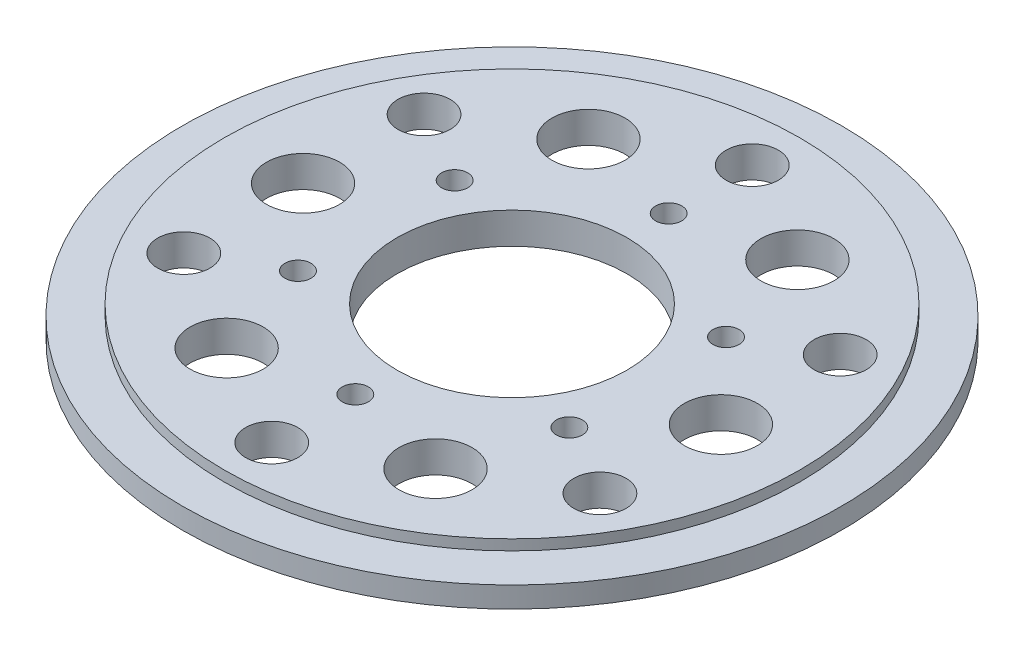
from build123d import *

# Parameters (mm, degrees)
SKETCH1_R             = 27.55
SKETCH1_R_2           = 11
BOSS_EXTRUDE1_DEPTH   = 3
SKETCH1_3_R           = 31.55
SKETCH1_3_R_2         = 27.55
BOSS_EXTRUDE2_DEPTH   = 2
M3X0_5_TAPPED_HOLE1_D = 2.5
SKETCH6_R             = 3.5
SKETCH6_R_2           = 2.5
CUT_EXTRUDE1_DEPTH    = 45.719179331
CIRPATTERN1_COUNT     = 6


with BuildPart() as part:
    # Sketch1 → Boss-Extrude1 (new body)
    with BuildSketch(Plane(origin=(0, 0, 0), x_dir=(1, 0, 0), z_dir=(0, 1, 0))):
        Circle(SKETCH1_R)
        Circle(SKETCH1_R_2, mode=Mode.SUBTRACT)
    extrude(amount=BOSS_EXTRUDE1_DEPTH)

    # Sketch1<3> → Boss-Extrude2 (add)
    with BuildSketch(Plane(origin=(0, 0, 0), x_dir=(1, 0, 0), z_dir=(0, 1, 0))):
        Circle(SKETCH1_3_R)
        Circle(SKETCH1_3_R_2, mode=Mode.SUBTRACT)
    extrude(amount=BOSS_EXTRUDE2_DEPTH)

    # M3x0.5 Tapped Hole1 (through all)
    with Locations(Plane(origin=(0, 3, 0), x_dir=(1, 0, 0), z_dir=(0, 1, 0))):
        with Locations((0, 15)):
            m3x0_5_tapped_hole1 = Hole(M3X0_5_TAPPED_HOLE1_D / 2)

    # Sketch6 → Cut-Extrude1 (cut, through all)
    with BuildSketch(Plane(origin=(0, 3, 0), x_dir=(1, 0, 0), z_dir=(0, 1, 0))):
        with Locations((20, 0)):
            Circle(SKETCH6_R)
        with Locations((0, 23)):
            Circle(SKETCH6_R_2)
    cut_extrude1 = extrude(amount=-CUT_EXTRUDE1_DEPTH, mode=Mode.SUBTRACT)

    # CirPattern1: M3x0.5 Tapped Hole1, Cut-Extrude1 ×6 about axis
    cirpattern1_axis = Axis((0, 3, 0), (0, -1, 0))
    add([m3x0_5_tapped_hole1.rotate(cirpattern1_axis, i * 360 / CIRPATTERN1_COUNT) for i in range(1, CIRPATTERN1_COUNT)], mode=Mode.SUBTRACT)
    add([cut_extrude1.rotate(cirpattern1_axis, i * 360 / CIRPATTERN1_COUNT) for i in range(1, CIRPATTERN1_COUNT)], mode=Mode.SUBTRACT)


solid = part.part
